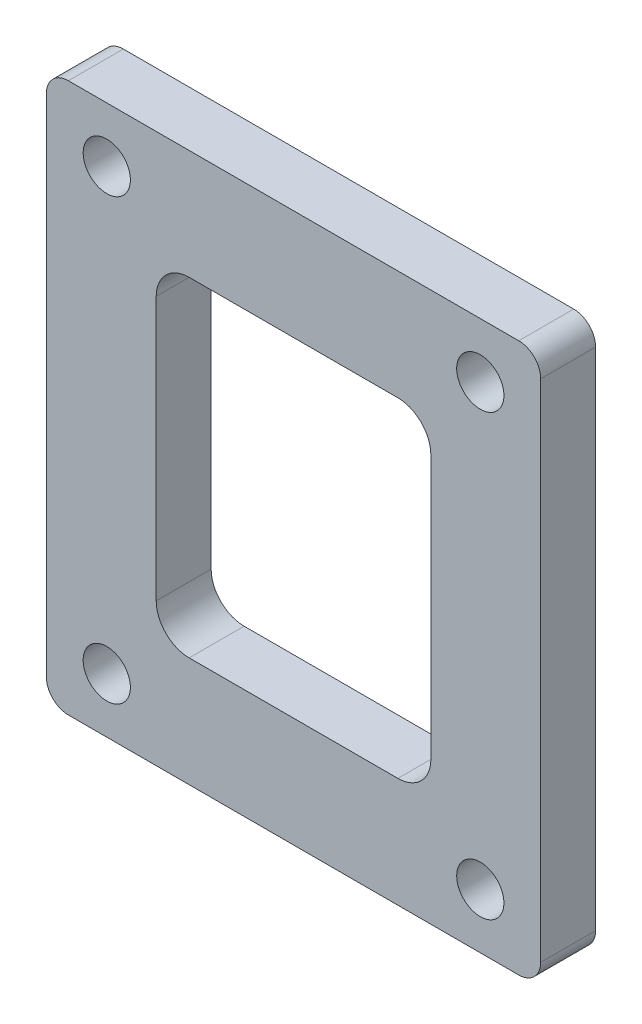
from build123d import *

# Parameters (mm, degrees)
SKETCH_1_W      = 45
SKETCH_1_H      = 50
SKETCH_1_R      = 2.15
SKETCH_1_W_2    = 25
SKETCH_1_H_2    = 30
EXTRUDE_1_DEPTH = 5
FILLET_1_R      = 2
FILLET_2_R      = 3


with BuildPart() as part:
    # ｽｹｯﾁ1 → ﾎﾞｽ - 押し出し1 (new body)
    with BuildSketch(Plane.XY):
        with Locations((22.5, 25)):
            Rectangle(SKETCH_1_W, SKETCH_1_H)
        with Locations((5.5, 5)):
            Circle(SKETCH_1_R, mode=Mode.SUBTRACT)
        with Locations(Location((5.5, 45, 0), (0, 0, 180))):
            Circle(SKETCH_1_R, mode=Mode.SUBTRACT)
        with Locations(Location((39.5, 5, 0), (0, 0, 180))):
            Circle(SKETCH_1_R, mode=Mode.SUBTRACT)
        with Locations((39.5, 45)):
            Circle(SKETCH_1_R, mode=Mode.SUBTRACT)
        with Locations((22.5, 25)):
            Rectangle(SKETCH_1_W_2, SKETCH_1_H_2, mode=Mode.SUBTRACT)
    extrude(amount=EXTRUDE_1_DEPTH)

    # ﾌｨﾚｯﾄ1
    fillet_1_edges = [part.edges().sort_by_distance(p)[0] for p in [
        (0, 50, 2.5),
        (45, 50, 2.5),
        (45, 0, 2.5),
        (0, 0, 2.5),
    ]]
    fillet(fillet_1_edges, radius=FILLET_1_R)

    # ﾌｨﾚｯﾄ2
    fillet_2_edges = [part.edges().sort_by_distance(p)[0] for p in [
        (35, 10, 2.5),
        (35, 40, 2.5),
        (10, 40, 2.5),
        (10, 10, 2.5),
    ]]
    fillet(fillet_2_edges, radius=FILLET_2_R)


solid = part.part
